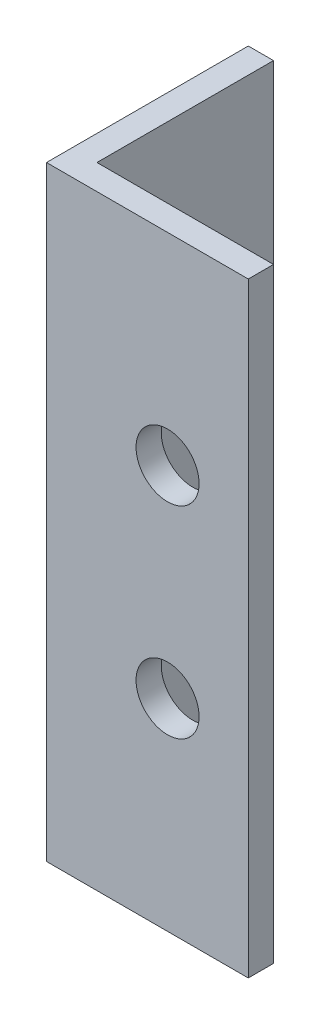
from build123d import *

# Parameters (mm, degrees)
BOSS_EXTRUDE1_DEPTH = 76.2
CUT_EXTRUDE1_REACH  = 86.242
SKETCH2_R           = 3.96875


with BuildPart() as part:
    # Sketch1 → Boss-Extrude1 (new body)
    with BuildSketch(Plane(origin=(0, 0, 0), x_dir=(1, 0, 0), z_dir=(0, 1, 0))):
        Polygon((0, 0), (25.4, 0), (25.4, 3.175), (3.175, 3.175), (3.175, 25.4), (0, 25.4), align=None)
    extrude(amount=BOSS_EXTRUDE1_DEPTH)

    # Sketch2 → Cut-Extrude1 (cut, up to next)
    with BuildSketch(Plane.XY, mode=Mode.PRIVATE) as cut_extrude1_sk1:
        with Locations((15.24, 25.4)):
            Circle(SKETCH2_R)
    cut_extrude1_tool1 = extrude(cut_extrude1_sk1.sketch, amount=-CUT_EXTRUDE1_REACH, mode=Mode.PRIVATE) & part.part
    # Sketch2 → Cut-Extrude1 (cut, up to next)
    with BuildSketch(Plane.XY, mode=Mode.PRIVATE) as cut_extrude1_sk2:
        with Locations((15.24, 50.8)):
            Circle(SKETCH2_R)
    cut_extrude1_tool2 = extrude(cut_extrude1_sk2.sketch, amount=-CUT_EXTRUDE1_REACH, mode=Mode.PRIVATE) & part.part
    add(cut_extrude1_tool1.solids().sort_by_distance((15.24, 25.4, 0))[0], mode=Mode.SUBTRACT)
    add(cut_extrude1_tool2.solids().sort_by_distance((15.24, 50.8, 0))[0], mode=Mode.SUBTRACT)


solid = part.part
